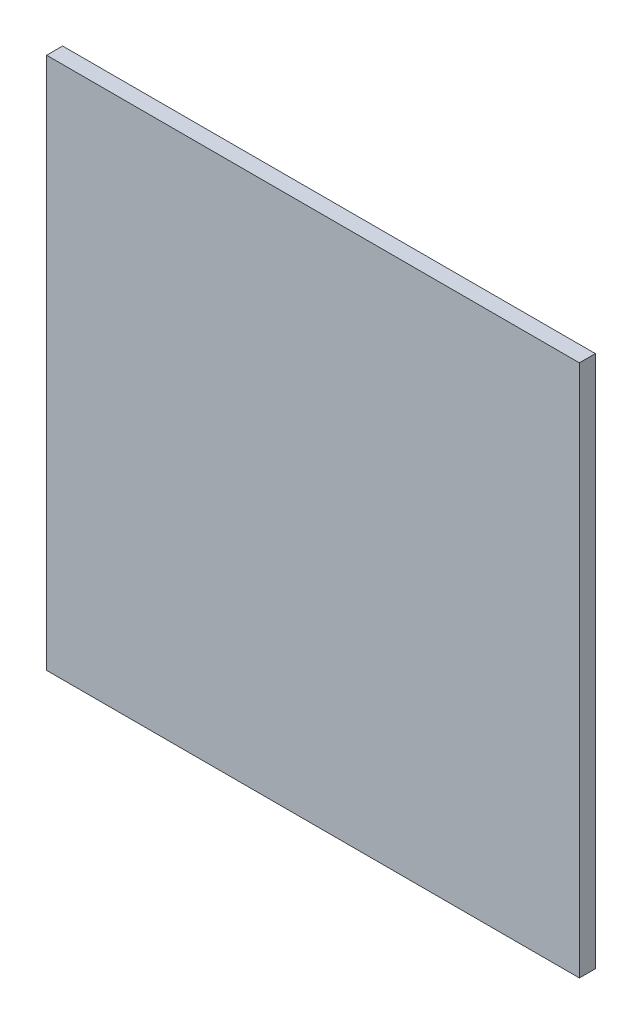
from build123d import *

# Parameters (mm, degrees)
SCHIZZO1_W                   = 500
SCHIZZO1_H                   = 500
ESTRUSIONE_ESTRUSIONE1_DEPTH = 15


with BuildPart() as part:
    # Schizzo1 → Estrusione-Estrusione1 (new body)
    with BuildSketch(Plane.XY):
        Rectangle(SCHIZZO1_W, SCHIZZO1_H)
    extrude(amount=ESTRUSIONE_ESTRUSIONE1_DEPTH)


solid = part.part
